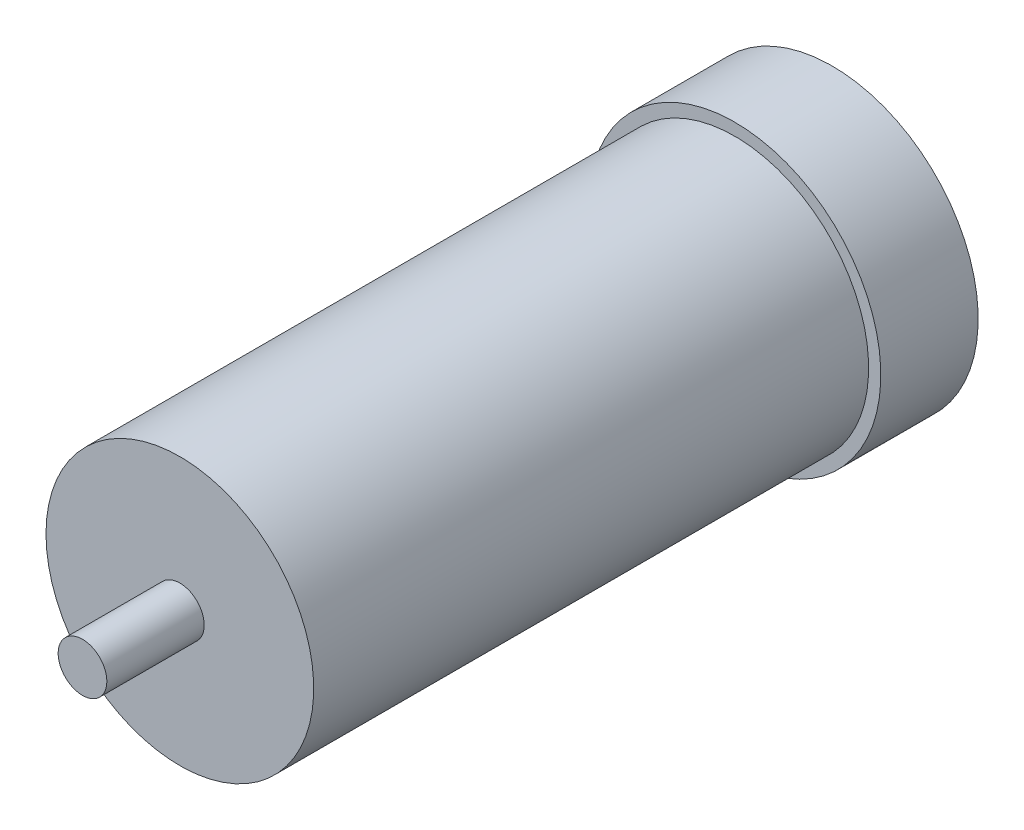
from build123d import *

# Parameters (mm, degrees)
SKETCH1_R           = 27.5
BOSS_EXTRUDE1_DEPTH = 114
SKETCH2_R           = 30
BOSS_EXTRUDE2_DEPTH = 20
SKETCH3_R           = 5
BOSS_EXTRUDE3_DEPTH = 20


with BuildPart() as part:
    # Sketch1 → Boss-Extrude1 (new body)
    with BuildSketch(Plane.XY):
        with Locations(Location((0, 0, 0), (0, 0, 180))):
            Circle(SKETCH1_R)
    extrude(amount=BOSS_EXTRUDE1_DEPTH)

    # Sketch2 → Boss-Extrude2 (add)
    with BuildSketch(Plane(origin=(0, 0, 0), x_dir=(-1, 0, 0), z_dir=(0, 0, -1))):
        Circle(SKETCH2_R)
    extrude(amount=BOSS_EXTRUDE2_DEPTH)

    # Sketch3 → Boss-Extrude3 (add)
    with BuildSketch(Plane.XY.offset(114)):
        Circle(SKETCH3_R)
    extrude(amount=BOSS_EXTRUDE3_DEPTH)


solid = part.part
